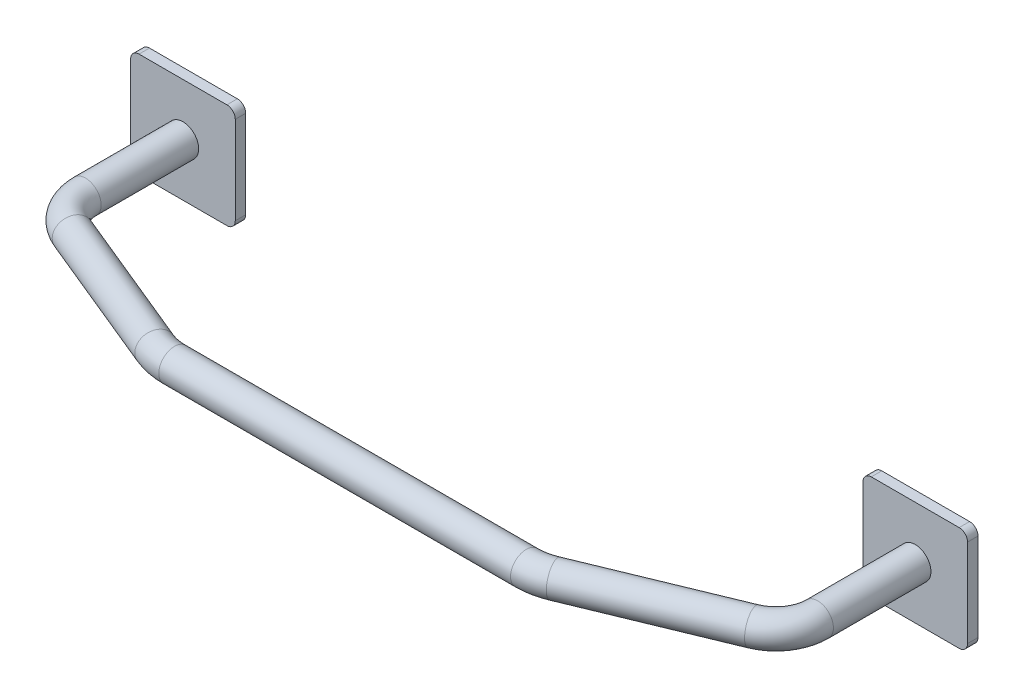
from build123d import *

# Parameters (mm, degrees)
SKETCH1_W           = 50
SKETCH1_H           = 50
BOSS_EXTRUDE1_DEPTH = 5
SWEEP1_PROFILE_R    = 7.5
FILLET1_R           = 4


with BuildPart() as part:
    # Sketch1 → Boss-Extrude1 (new body)
    with BuildSketch(Plane.XY):
        with Locations((-175, 0)):
            Rectangle(SKETCH1_W, SKETCH1_H)
    extrude(amount=BOSS_EXTRUDE1_DEPTH)

    # Sweep1: sweep along a path in Sketch2
    with BuildLine(Plane(origin=(0, 0, 0), x_dir=(1, 0, 0), z_dir=(0, 1, 0))) as sweep1_path:
        Line((-175, -5), (-175, -51.606145517))
        ThreePointArc((-175, -51.606145517), (-171.61776041, -62.734938755), (-162.614996105, -70.099707486))
        Line((-162.614996105, -70.099707486), (-95.48773854, -97.740342954))
        ThreePointArc((-95.48773854, -97.740342954), (-89.887173245, -99.42966436), (-84.065244382, -100))
        Line((-84.065244382, -100), (0, -100))
    # Sweep1 profile (on start of the path) → Sweep1 (sweep)
    with BuildSketch(Plane(origin=(-175, 0, 5), x_dir=(1, 0, 0), z_dir=(0, 0, 1))):
        Circle(SWEEP1_PROFILE_R)
    sweep(path=sweep1_path.line)

    # Fillet1
    fillet1_edges = [part.edges().sort_by_distance(p)[0] for p in [
        (-150, -25, 2.5),
        (-200, -25, 2.5),
        (-200, 25, 2.5),
        (-150, 25, 2.5),
    ]]
    fillet(fillet1_edges, radius=FILLET1_R)

    # Mirror1: part across plane


with BuildPart() as part_1:
    add(part.part)
    add(part.part.mirror(Plane(origin=(0, 0, 0), x_dir=(0, 0, 1), z_dir=(1, 0, 0))))


solid = part_1.part
